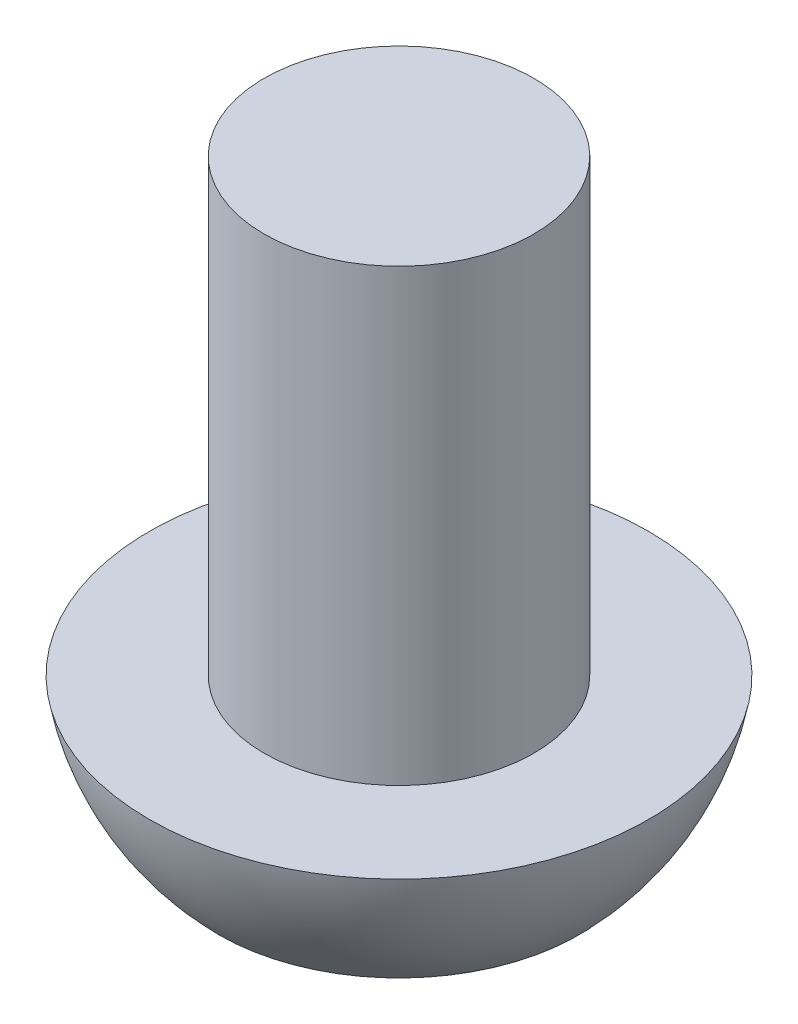
from build123d import *

# Parameters (mm, degrees)
SKETCH_1_R          = 1.5
EXTRUDE_1_DEPTH     = 2
SKETCH_2_R          = 2.775
EXTRUDE_2_DEPTH     = 1.5
CUT_EXTRUDE_1_DEPTH = 1
SKETCH_1_8_R        = 1.5
EXTRUDE_5_DEPTH     = 5


with BuildPart() as part:
    # 草图1 → 拉伸1 (new body)
    with BuildSketch(Plane(origin=(0, 0, 0), x_dir=(1, 0, 0), z_dir=(0, 1, 0))):
        Circle(SKETCH_1_R)
    extrude(amount=EXTRUDE_1_DEPTH)

    # 草图2 → Extrude 2 (add)
    with BuildSketch(Plane(origin=(0, 0, 0), x_dir=(-1, 0, 0), z_dir=(0, 1, 0))):
        Circle(SKETCH_2_R)
    extrude(amount=-EXTRUDE_2_DEPTH)

    # 草图4 → 切除-旋转1 (revolve, cut)
    with BuildSketch(Plane(origin=(0, 0, 0), x_dir=(0, 0, -1), z_dir=(1, 0, 0))):
        with BuildLine():
            Line((-2.775, 0), (-2.775, -1.5))
            Line((-2.775, -1.5), (-2, -1.5))
            ThreePointArc((-2, -1.5), (-2.50252997, -0.809432151), (-2.775, 0))
        make_face()
    revolve(axis=Axis((0, 3.165730861, 0), (0, -1, 0)), mode=Mode.SUBTRACT)

    # 草图3 → 切除-拉伸1 (cut)
    with BuildSketch(Plane.XZ.offset(1.5)):
        Polygon((-1.177794549, 0), (-0.588897275, -1.02), (0.588897275, -1.02), (1.177794549, 0), (0.588897275, 1.02), (-0.588897275, 1.02), align=None)
    extrude(amount=-CUT_EXTRUDE_1_DEPTH, mode=Mode.SUBTRACT)

    # 草图1<8> → 凸台-拉伸5 (add)
    with BuildSketch(Plane(origin=(0, 0, 0), x_dir=(1, 0, 0), z_dir=(0, 1, 0))):
        Circle(SKETCH_1_8_R)
    extrude(amount=EXTRUDE_5_DEPTH)


solid = part.part
